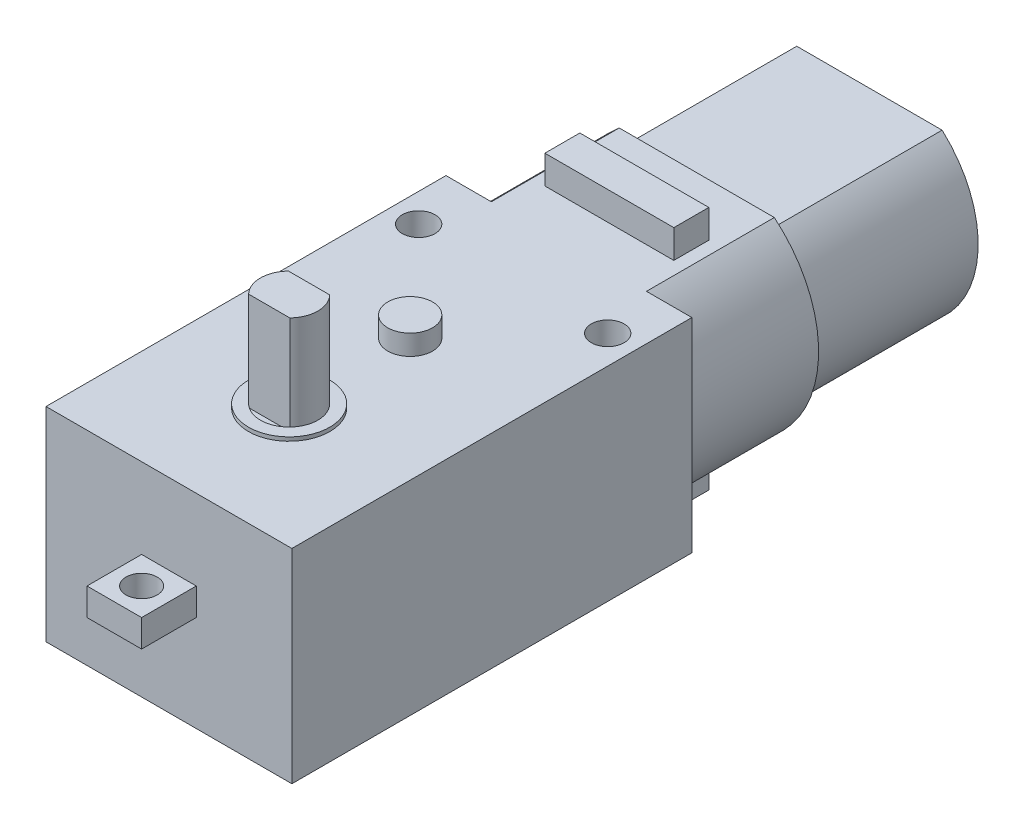
from build123d import *

# Parameters (mm, degrees)
SKETCH1_W           = 22.5
SKETCH1_H           = 36.6
BOSS_EXTRUDE1_DEPTH = 18.65
SKETCH1_3_W         = 22.3
SKETCH1_3_H         = 11.7
BOSS_EXTRUDE2_DEPTH = 17.2
SKETCH1_4_W         = 11.8
SKETCH1_4_H         = 3.2
BOSS_EXTRUDE3_DEPTH = 2.6
CUT_EXTRUDE1_REACH  = 44.59
BOSS_EXTRUDE4_DEPTH = 15.8
SKETCH5_R           = 1
BOSS_EXTRUDE5_DEPTH = 1.25
SKETCH6_W           = 5
SKETCH6_H           = 2.5
BOSS_EXTRUDE6_DEPTH = 5
CUT_EXTRUDE2_REACH  = 58.881
SKETCH7_R           = 1.425
SKETCH1_5_R         = 3.725
SKETCH1_5_R_2       = 2.625
BOSS_EXTRUDE7_DEPTH = 0.35
SKETCH1_6_R         = 2.05
BOSS_EXTRUDE8_DEPTH = 1.85
BOSS_EXTRUDE9_DEPTH = 9
CUT_EXTRUDE3_REACH  = 64.008
SKETCH8_R           = 1.5


with BuildPart() as part:
    # Sketch1 → Boss-Extrude1 (new body)
    with BuildSketch(Plane(origin=(0, 0, 0), x_dir=(1, 0, 0), z_dir=(0, 1, 0))):
        with Locations((0, 7.3)):
            Rectangle(SKETCH1_W, SKETCH1_H)
    extrude(amount=-BOSS_EXTRUDE1_DEPTH)

    # Sketch1<3> → Boss-Extrude2 (add)
    with BuildSketch(Plane(origin=(0, 0, 0), x_dir=(1, 0, 0), z_dir=(0, 1, 0))):
        with Locations((0, 31.45)):
            Rectangle(SKETCH1_3_W, SKETCH1_3_H)
    extrude(amount=-BOSS_EXTRUDE2_DEPTH)

    # Sketch1<4> → Boss-Extrude3 (add)
    with BuildSketch(Plane(origin=(0, 0, 0), x_dir=(1, 0, 0), z_dir=(0, 1, 0))):
        with Locations((0, 30.9)):
            Rectangle(SKETCH1_4_W, SKETCH1_4_H)
    boss_extrude3 = extrude(amount=BOSS_EXTRUDE3_DEPTH)

    # Sketch3 → Cut-Extrude1 (cut, up to next)
    with BuildSketch(Plane(origin=(0, 0, -25.6), x_dir=(-1, 0, 0), z_dir=(0, 0, -1)), mode=Mode.PRIVATE) as cut_extrude1_sk1:
        with BuildLine():
            ThreePointArc((11.15, -8.600000119), (10.085885996, -13.353672651), (7.096654141, -17.2))
            Line((7.096654141, -17.2), (11.15, -17.2))
            Line((11.15, -17.2), (11.15, -8.600000119))
        make_face()
    cut_extrude1_tool1 = extrude(cut_extrude1_sk1.sketch, amount=CUT_EXTRUDE1_REACH, mode=Mode.PRIVATE) & part.part
    # Sketch3 → Cut-Extrude1 (cut, up to next)
    with BuildSketch(Plane(origin=(0, 0, -25.6), x_dir=(-1, 0, 0), z_dir=(0, 0, -1)), mode=Mode.PRIVATE) as cut_extrude1_sk2:
        with BuildLine():
            Line((-11.15, -17.2), (-7.096654141, -17.2))
            ThreePointArc((-7.096654141, -17.2), (-10.085886021, -13.353672597), (-11.15, -8.6))
            Line((-11.15, -8.6), (-11.15, -17.2))
        make_face()
    cut_extrude1_tool2 = extrude(cut_extrude1_sk2.sketch, amount=CUT_EXTRUDE1_REACH, mode=Mode.PRIVATE) & part.part
    # Sketch3 → Cut-Extrude1 (cut, up to next)
    with BuildSketch(Plane(origin=(0, 0, -25.6), x_dir=(-1, 0, 0), z_dir=(0, 0, -1)), mode=Mode.PRIVATE) as cut_extrude1_sk3:
        with BuildLine():
            ThreePointArc((7.096654141, 0), (10.085886047, -3.846327457), (11.15, -8.600000119))
            Line((11.15, -8.600000119), (11.15, 0))
            Line((11.15, 0), (7.096654141, 0))
        make_face()
    cut_extrude1_tool3 = extrude(cut_extrude1_sk3.sketch, amount=CUT_EXTRUDE1_REACH, mode=Mode.PRIVATE) & part.part
    # Sketch3 → Cut-Extrude1 (cut, up to next)
    with BuildSketch(Plane(origin=(0, 0, -25.6), x_dir=(-1, 0, 0), z_dir=(0, 0, -1)), mode=Mode.PRIVATE) as cut_extrude1_sk4:
        with BuildLine():
            Line((-11.15, 0), (-11.15, -8.6))
            ThreePointArc((-11.15, -8.6), (-10.085886021, -3.846327403), (-7.096654141, 0))
            Line((-7.096654141, 0), (-11.15, 0))
        make_face()
    cut_extrude1_tool4 = extrude(cut_extrude1_sk4.sketch, amount=CUT_EXTRUDE1_REACH, mode=Mode.PRIVATE) & part.part
    add(cut_extrude1_tool1.solids().sort_by_distance((-9.984236, -15.135971, -25.6))[0], mode=Mode.SUBTRACT)
    add(cut_extrude1_tool2.solids().sort_by_distance((9.984236, -15.135971, -25.6))[0], mode=Mode.SUBTRACT)
    add(cut_extrude1_tool3.solids().sort_by_distance((-9.984236, -2.064029, -25.6))[0], mode=Mode.SUBTRACT)
    add(cut_extrude1_tool4.solids().sort_by_distance((9.984236, -2.064029, -25.6))[0], mode=Mode.SUBTRACT)

    # Sketch4 → Boss-Extrude4 (add)
    with BuildSketch(Plane(origin=(0, 0, -37.3), x_dir=(-1, 0, 0), z_dir=(0, 0, -1))):
        with BuildLine():
            Line((6.651503589, -1.2), (-6.651503589, -1.2))
            ThreePointArc((-6.651503589, -1.2), (-9.95, -8.6), (-6.651503589, -16))
            Line((-6.651503589, -16), (6.651503589, -16))
            ThreePointArc((6.651503589, -16), (9.95, -8.6), (6.651503589, -1.2))
        make_face()
    extrude(amount=BOSS_EXTRUDE4_DEPTH)

    # Sketch5 → Boss-Extrude5 (add)
    with BuildSketch(Plane(origin=(0, 0, -53.1), x_dir=(-1, 0, 0), z_dir=(0, 0, -1))):
        with Locations((0, -8.6)):
            Circle(SKETCH5_R)
    extrude(amount=BOSS_EXTRUDE5_DEPTH)

    # Mirror1: Boss-Extrude3 across plane
    add(boss_extrude3.mirror(Plane.ZX.offset(-8.6)))

    # Sketch6 → Boss-Extrude6 (add)
    with BuildSketch(Plane.XY.offset(11)):
        with Locations((0, -8.6)):
            Rectangle(SKETCH6_W, SKETCH6_H)
    extrude(amount=BOSS_EXTRUDE6_DEPTH)

    # Sketch7 → Cut-Extrude2 (cut, up to next)
    with BuildSketch(Plane(origin=(0, -7.35, 0), x_dir=(1, 0, 0), z_dir=(0, 1, 0)), mode=Mode.PRIVATE) as cut_extrude2_sk1:
        with Locations(Location((0, -13.5, 0), (0, 0, 270))):
            Circle(SKETCH7_R)
    cut_extrude2_tool1 = extrude(cut_extrude2_sk1.sketch, amount=-CUT_EXTRUDE2_REACH, mode=Mode.PRIVATE) & part.part
    add(cut_extrude2_tool1.solids().sort_by_distance((0, -7.35, 13.5))[0], mode=Mode.SUBTRACT)

    # Sketch1<5> → Boss-Extrude7 (add)
    with BuildSketch(Plane(origin=(0, 0, 0), x_dir=(1, 0, 0), z_dir=(0, 1, 0))):
        with Locations(Location((0, 0, 0), (0, 0, 270))):
            Circle(SKETCH1_5_R)
        with Locations(Location((0, 0, 0), (0, 0, 270))):
            Circle(SKETCH1_5_R_2, mode=Mode.SUBTRACT)
    extrude(amount=BOSS_EXTRUDE7_DEPTH)

    # Sketch1<6> → Boss-Extrude8 (add)
    with BuildSketch(Plane(origin=(0, 0, 0), x_dir=(1, 0, 0), z_dir=(0, 1, 0))):
        with Locations(Location((0, 11.075, 0), (0, 0, 270))):
            Circle(SKETCH1_6_R)
    extrude(amount=BOSS_EXTRUDE8_DEPTH)

    # Sketch1<7> → Boss-Extrude9 (add)
    with BuildSketch(Plane(origin=(0, 0, 0), x_dir=(1, 0, 0), z_dir=(0, 1, 0))):
        with BuildLine():
            ThreePointArc((-1.886796226, 1.825), (-2.625, 0), (-1.886796226, -1.825))
            Line((-1.886796226, -1.825), (1.886796226, -1.825))
            ThreePointArc((1.886796226, -1.825), (2.433461022, -0.984323348), (2.625, 0))
            ThreePointArc((2.625, 0), (2.433461022, 0.984323348), (1.886796226, 1.825))
            Line((1.886796226, 1.825), (-1.886796226, 1.825))
        make_face()
    extrude(amount=BOSS_EXTRUDE9_DEPTH)

    # Sketch8 → Cut-Extrude3 (cut, up to next)
    with BuildSketch(Plane.XZ.offset(18.65), mode=Mode.PRIVATE) as cut_extrude3_sk1:
        with Locations(Location((8.65, -20.5, 0), (0, 0, 270))):
            Circle(SKETCH8_R)
    cut_extrude3_tool1 = extrude(cut_extrude3_sk1.sketch, amount=-CUT_EXTRUDE3_REACH, mode=Mode.PRIVATE) & part.part
    # Sketch8 → Cut-Extrude3 (cut, up to next)
    with BuildSketch(Plane.XZ.offset(18.65), mode=Mode.PRIVATE) as cut_extrude3_sk2:
        with Locations(Location((-8.65, -20.5, 0), (0, 0, 270))):
            Circle(SKETCH8_R)
    cut_extrude3_tool2 = extrude(cut_extrude3_sk2.sketch, amount=-CUT_EXTRUDE3_REACH, mode=Mode.PRIVATE) & part.part
    add(cut_extrude3_tool1.solids().sort_by_distance((8.65, -18.65, -20.5))[0], mode=Mode.SUBTRACT)
    add(cut_extrude3_tool2.solids().sort_by_distance((-8.65, -18.65, -20.5))[0], mode=Mode.SUBTRACT)


solid = part.part
